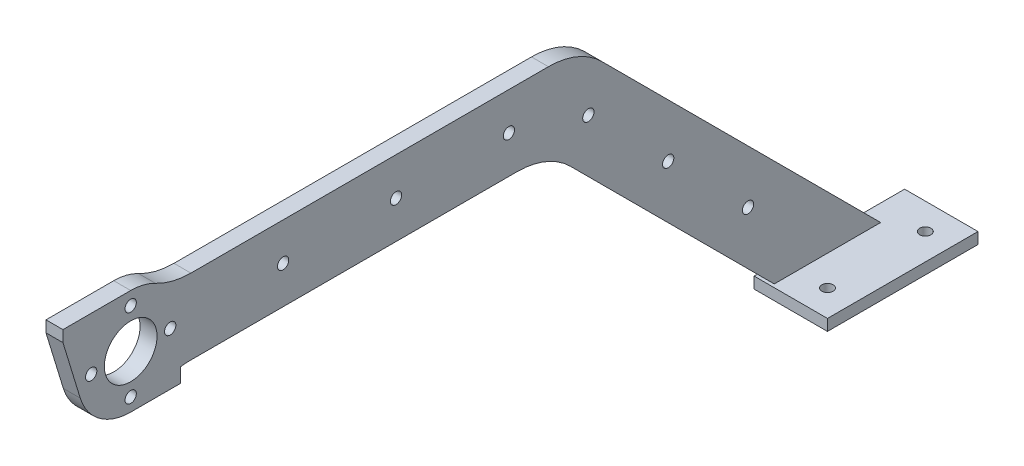
from build123d import *

# Parameters (mm, degrees)
SKETCH_1_R          = 1.5
SKETCH_1_R_2        = 7
EXTRUDE_1_DEPTH     = 2.25
SKETCH_5_W          = 19.5
SKETCH_5_H          = 40
EXTRUDE_3_DEPTH     = 3
SKETCH_6_R          = 1.5
CUT_EXTRUDE_2_DEPTH = 227.967348396


with BuildPart() as part:
    # 草图1 → 凸台-拉伸1 (new, symmetric)
    with BuildSketch(Plane(origin=(0, 0, 0), x_dir=(0, 0, -1), z_dir=(1, 0, 0))):
        with BuildLine():
            ThreePointArc((102.736907967, -10), (110.379173808, -11.526455333), (116.85785315, -15.85785315))
            Line((116.85785315, -15.85785315), (171, -70))
            Line((171, -70), (199.284271247, -70))
            Line((199.284271247, -70), (125.142135624, 4.142135624))
            ThreePointArc((125.142135624, 4.142135624), (118.653668647, 8.47759065), (111, 10))
            Line((111, 10), (16, 10))
            ThreePointArc((16, 10), (11.149287499, 10.597149997), (6.588235294, 12.352941176))
            ThreePointArc((6.588235294, 12.352941176), (3.395498751, 13.581995002), (0, 14))
            Line((0, 14), (-18, 14))
            Line((-18, 14), (-18, 11))
            Line((-18, 11), (-13.388941598, -4.090995342))
            ThreePointArc((-13.388941598, -4.090995342), (-8.328447191, -11.253309175), (0, -14))
            Line((0, -14), (13.224243357, -14))
            Line((13.224243357, -14), (13.224243357, -10.193557234))
            ThreePointArc((13.224243357, -10.193557234), (14.608751519, -10.048447989), (16, -10))
            Line((16, -10), (102.736907967, -10))
        make_face()
        with Locations((164.036406871, -48.894271247)):
            Circle(SKETCH_1_R, mode=Mode.SUBTRACT)
        with Locations((142.823203436, -27.681067812)):
            Circle(SKETCH_1_R, mode=Mode.SUBTRACT)
        with Locations((0, -10.5)):
            Circle(SKETCH_1_R, mode=Mode.SUBTRACT)
        with Locations((-10.5, 0)):
            Circle(SKETCH_1_R, mode=Mode.SUBTRACT)
        Circle(SKETCH_1_R_2, mode=Mode.SUBTRACT)
        with Locations((10.5, 0)):
            Circle(SKETCH_1_R, mode=Mode.SUBTRACT)
        with Locations((0, 10.5)):
            Circle(SKETCH_1_R, mode=Mode.SUBTRACT)
        with Locations((40.5, 0)):
            Circle(SKETCH_1_R, mode=Mode.SUBTRACT)
        with Locations((70.5, 0)):
            Circle(SKETCH_1_R, mode=Mode.SUBTRACT)
        with Locations((121.61, -6.467864376)):
            Circle(SKETCH_1_R, mode=Mode.SUBTRACT)
        with Locations((100.5, 0)):
            Circle(SKETCH_1_R, mode=Mode.SUBTRACT)
    extrude(amount=EXTRUDE_1_DEPTH, both=True)

    # 草图5 → 凸台-拉伸3 (add)
    with BuildSketch(Plane.XZ.offset(70)):
        with Locations((7.5, -190.144271247)):
            Rectangle(SKETCH_5_W, SKETCH_5_H)
    extrude(amount=EXTRUDE_3_DEPTH)

    # 草图6 → 切除-拉伸2 (cut, through all)
    with BuildSketch(Plane(origin=(0, -70, 0), x_dir=(1, 0, 0), z_dir=(0, 1, 0))):
        with Locations(Location((10.25, 203.144271247, 0), (0, 0, 270))):
            Circle(SKETCH_6_R)
        with Locations(Location((10.25, 177.144271247, 0), (0, 0, 90))):
            Circle(SKETCH_6_R)
    extrude(amount=-CUT_EXTRUDE_2_DEPTH, mode=Mode.SUBTRACT)


solid = part.part
